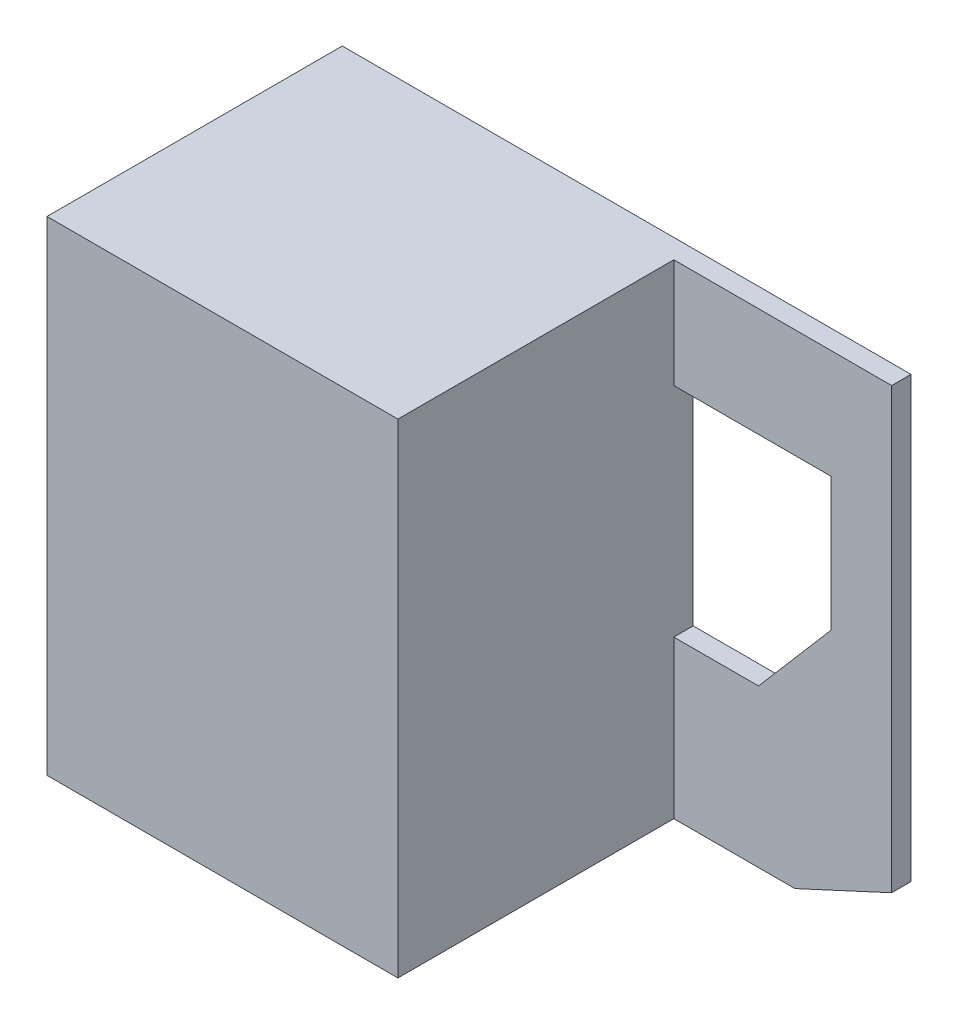
from build123d import *

# Parameters (mm, degrees)
CROQUIS1_W              = 29
CROQUIS1_H              = 40
SALIENTE_EXTRUIR1_DEPTH = 24.4
SALIENTE_EXTRUIR2_DEPTH = 1.6
CROQUIS3_R              = 5
CORTAR_EXTRUIR1_DEPTH   = 34


with BuildPart() as part:
    # Croquis1 → Saliente-Extruir1 (new body)
    with BuildSketch(Plane.XY):
        Rectangle(CROQUIS1_W, CROQUIS1_H)
    extrude(amount=SALIENTE_EXTRUIR1_DEPTH)

    # Croquis2 → Saliente-Extruir2 (add)
    with BuildSketch(Plane.XY):
        Polygon((14.5, 20), (32.5, 20), (32.5, -16.3), (24.5, -20), (14.5, -20), (14.5, -7), (21.5, -7), (27.5, 0), (27.5, 11), (14.5, 11), align=None)
    extrude(amount=SALIENTE_EXTRUIR2_DEPTH)

    # Croquis3 → Cortar-Extruir1 (cut)
    with BuildSketch(Plane.XZ.offset(20)):
        with Locations(Location((0, 13, 0), (0, 0, 270))):
            Circle(CROQUIS3_R)
    extrude(amount=-CORTAR_EXTRUIR1_DEPTH, mode=Mode.SUBTRACT)


solid = part.part
